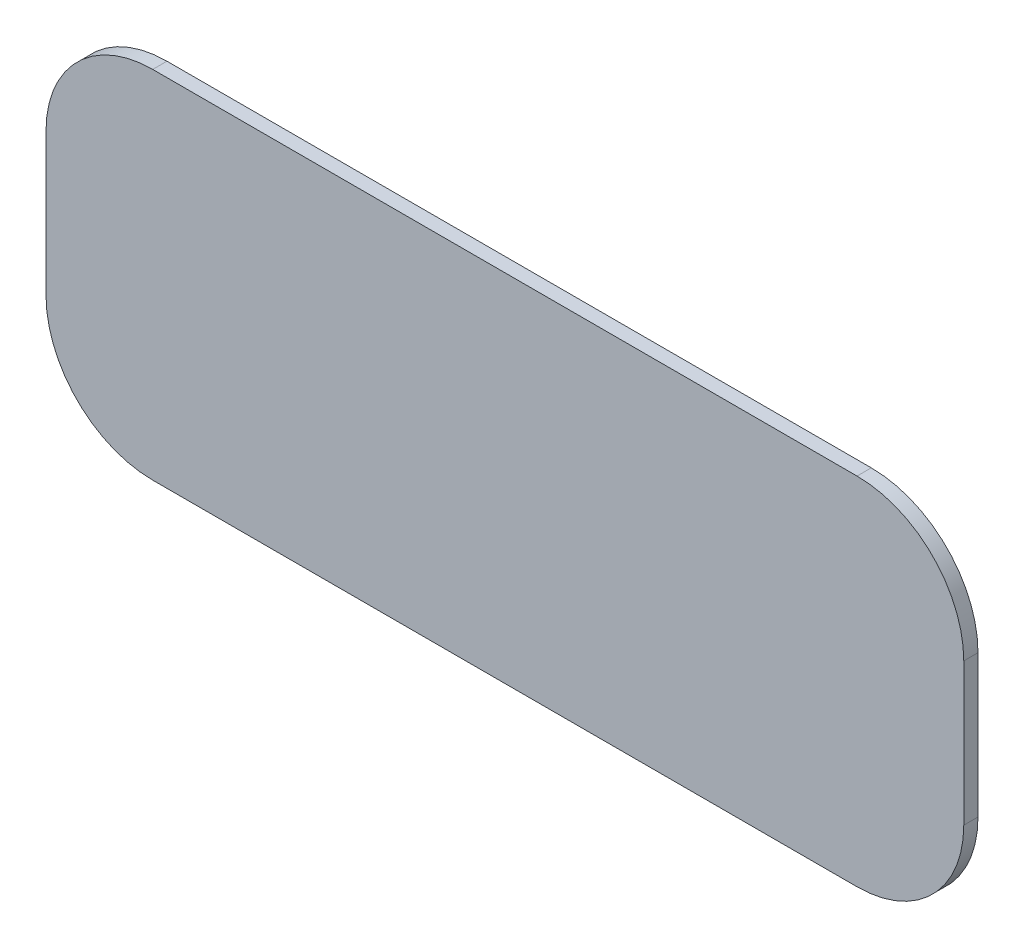
from build123d import *

# Parameters (mm, degrees)
ESQUISSE1_W        = 129
ESQUISSE1_H        = 50
BOSS_EXTRU_1_DEPTH = 2
CONG_1_R           = 15


with BuildPart() as part:
    # Esquisse1 → Boss.-Extru.1 (new body)
    with BuildSketch(Plane.XY):
        with Locations((-64.5, 25)):
            Rectangle(ESQUISSE1_W, ESQUISSE1_H)
    extrude(amount=BOSS_EXTRU_1_DEPTH)

    # Congé1
    cong_1_edges = [part.edges().sort_by_distance(p)[0] for p in [
        (0, 0, 1),
        (-129, 0, 1),
        (-129, 50, 1),
        (0, 50, 1),
    ]]
    fillet(cong_1_edges, radius=CONG_1_R)


solid = part.part
